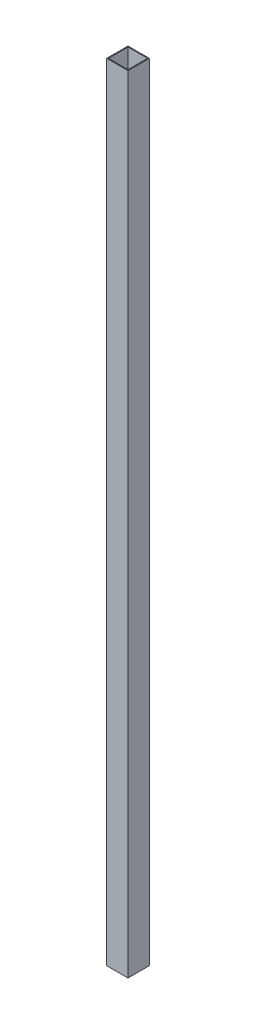
from build123d import *

# Parameters (mm, degrees)
SKETCH1_W           = 25
SKETCH1_H           = 25
SKETCH1_W_2         = 23
SKETCH1_H_2         = 23
BOSS_EXTRUDE1_DEPTH = 922.5


with BuildPart() as part:
    # Sketch1 → Boss-Extrude1 (new body)
    with BuildSketch(Plane(origin=(0, 0, 0), x_dir=(1, 0, 0), z_dir=(0, 1, 0))):
        Rectangle(SKETCH1_W, SKETCH1_H)
        Rectangle(SKETCH1_W_2, SKETCH1_H_2, mode=Mode.SUBTRACT)
    extrude(amount=BOSS_EXTRUDE1_DEPTH)


solid = part.part
